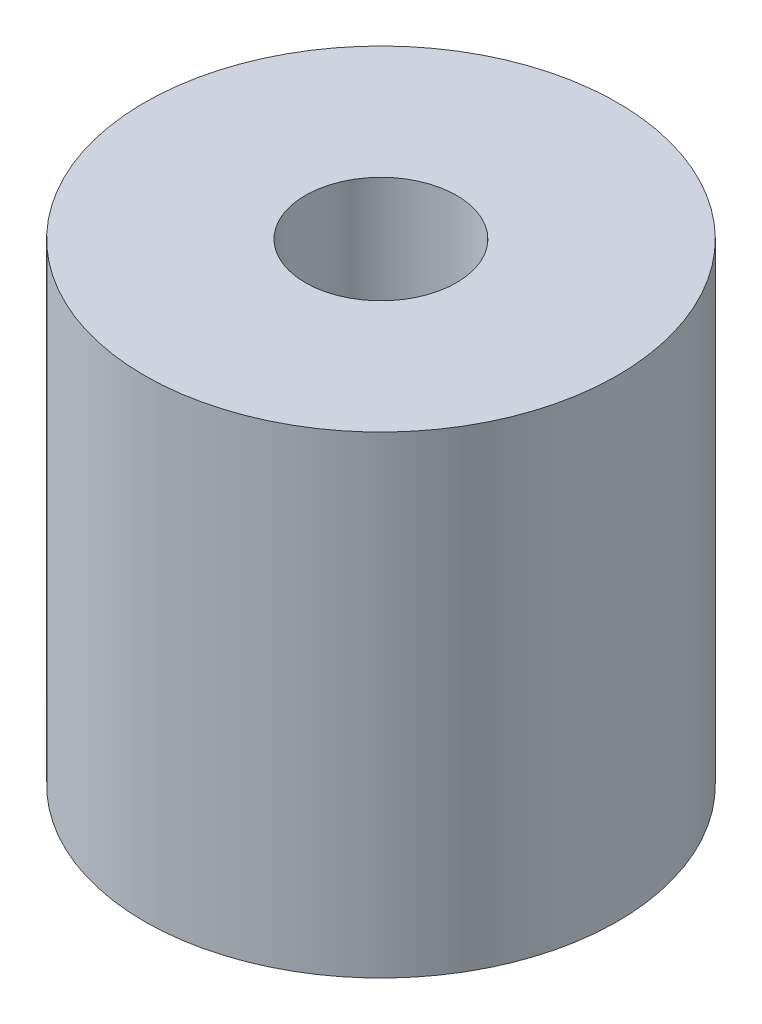
from build123d import *

# Parameters (mm, degrees)
SKETCH1_R           = 5
SKETCH1_R_2         = 1.6
BOSS_EXTRUDE1_DEPTH = 10


with BuildPart() as part:
    # Sketch1 → Boss-Extrude1 (new body)
    with BuildSketch(Plane(origin=(0, 0, 0), x_dir=(1, 0, 0), z_dir=(0, 1, 0))):
        with Locations(Location((0, 0, 0), (0, 0, 270))):
            Circle(SKETCH1_R)
        with Locations(Location((0, 0, 0), (0, 0, 270))):
            Circle(SKETCH1_R_2, mode=Mode.SUBTRACT)
    extrude(amount=BOSS_EXTRUDE1_DEPTH)


solid = part.part
